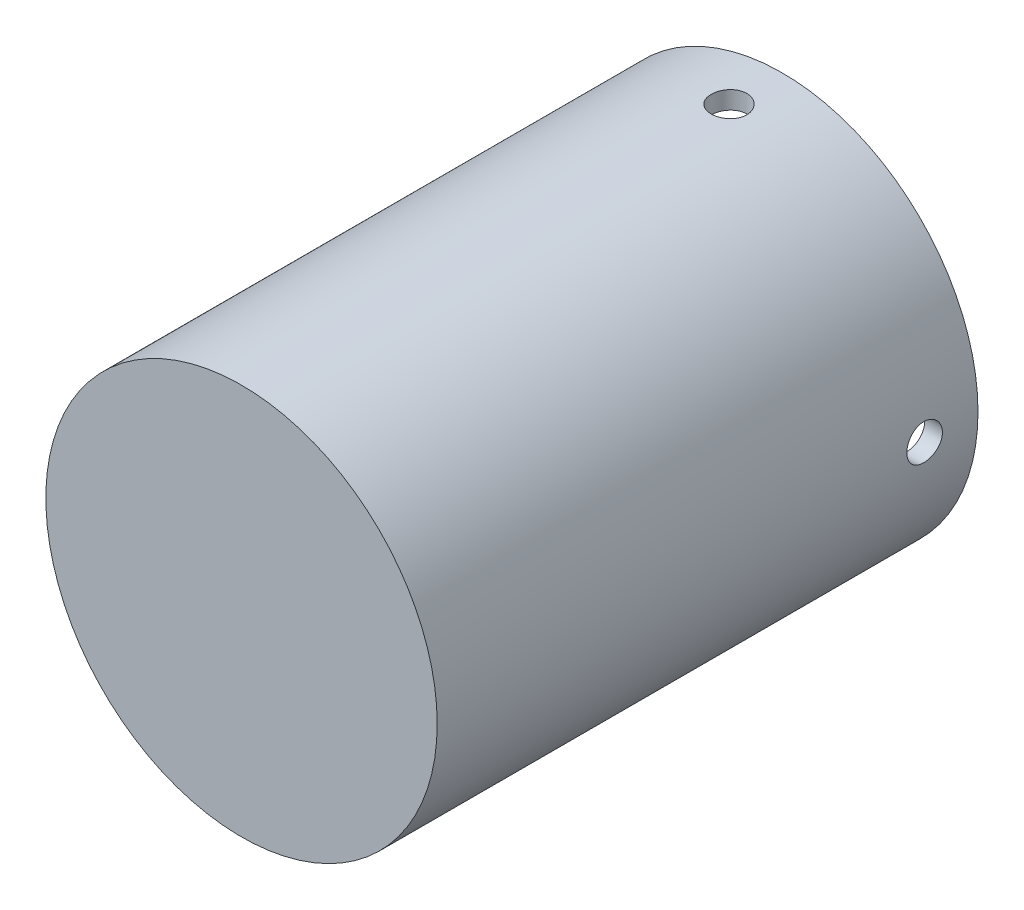
from build123d import *

# Parameters (mm, degrees)
SKETCH1_R    = 55
CUP_DEPTH    = 152
SKETCH2_R    = 50
CAVITY_DEPTH = 148
SKETCH3_R    = 5
VENT_DEPTH   = 6
VENTS_COUNT  = 4


with BuildPart() as part:
    # Sketch1 → Cup (new body)
    with BuildSketch(Plane.XY):
        Circle(SKETCH1_R)
    extrude(amount=CUP_DEPTH)

    # Sketch2 → Cavity (cut)
    with BuildSketch(Plane.XY):
        Circle(SKETCH2_R)
    extrude(amount=CAVITY_DEPTH, mode=Mode.SUBTRACT)

    # Sketch3 → Vent (cut)
    with BuildSketch(Plane(origin=(49.5, 0, 0), x_dir=(0, 0, -1), z_dir=(1, 0, 0))):
        with Locations(Location((-15, 0, 0), (0, 0, 180))):
            Circle(SKETCH3_R)
    vent = extrude(amount=VENT_DEPTH, mode=Mode.SUBTRACT)

    # Vents: Vent ×4 about axis
    vents_axis = Axis((0, 0, -7.6), (0, 0, 1))
    for i in range(1, VENTS_COUNT):
        add(vent.rotate(vents_axis, i * 360 / VENTS_COUNT), mode=Mode.SUBTRACT)


solid = part.part
